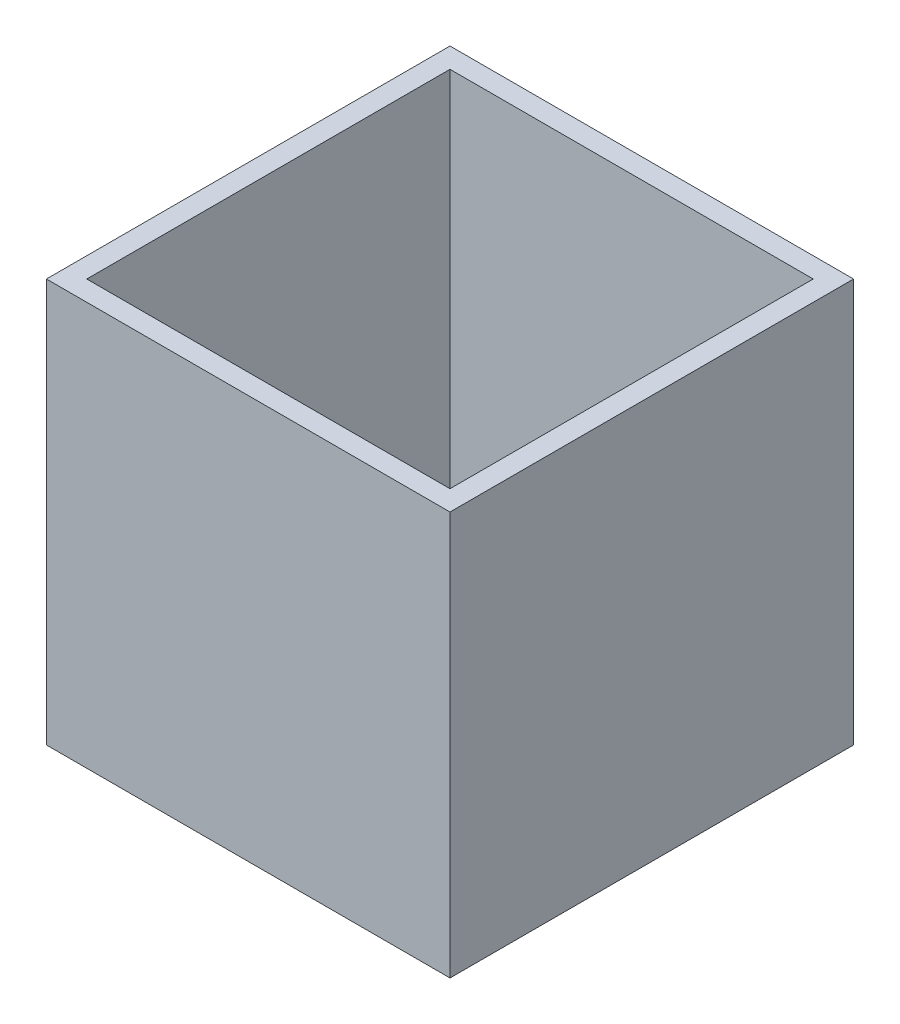
from build123d import *

# Parameters (mm, degrees)
SKETCH2_W           = 100
SKETCH2_H           = 100
BOSS_EXTRUDE1_DEPTH = 100
SHELL1_T            = -5


with BuildPart() as part:
    # Sketch2 → Boss-Extrude1 (new body)
    with BuildSketch(Plane(origin=(0, 0, 0), x_dir=(1, 0, 0), z_dir=(0, 1, 0))):
        Rectangle(SKETCH2_W, SKETCH2_H)
    extrude(amount=BOSS_EXTRUDE1_DEPTH)

    # Shell1
    shell1_openings = [part.faces().sort_by_distance(p)[0] for p in [
        (0, 100, 0),
    ]]
    offset(amount=SHELL1_T, openings=shell1_openings, kind=Kind.INTERSECTION)


solid = part.part
